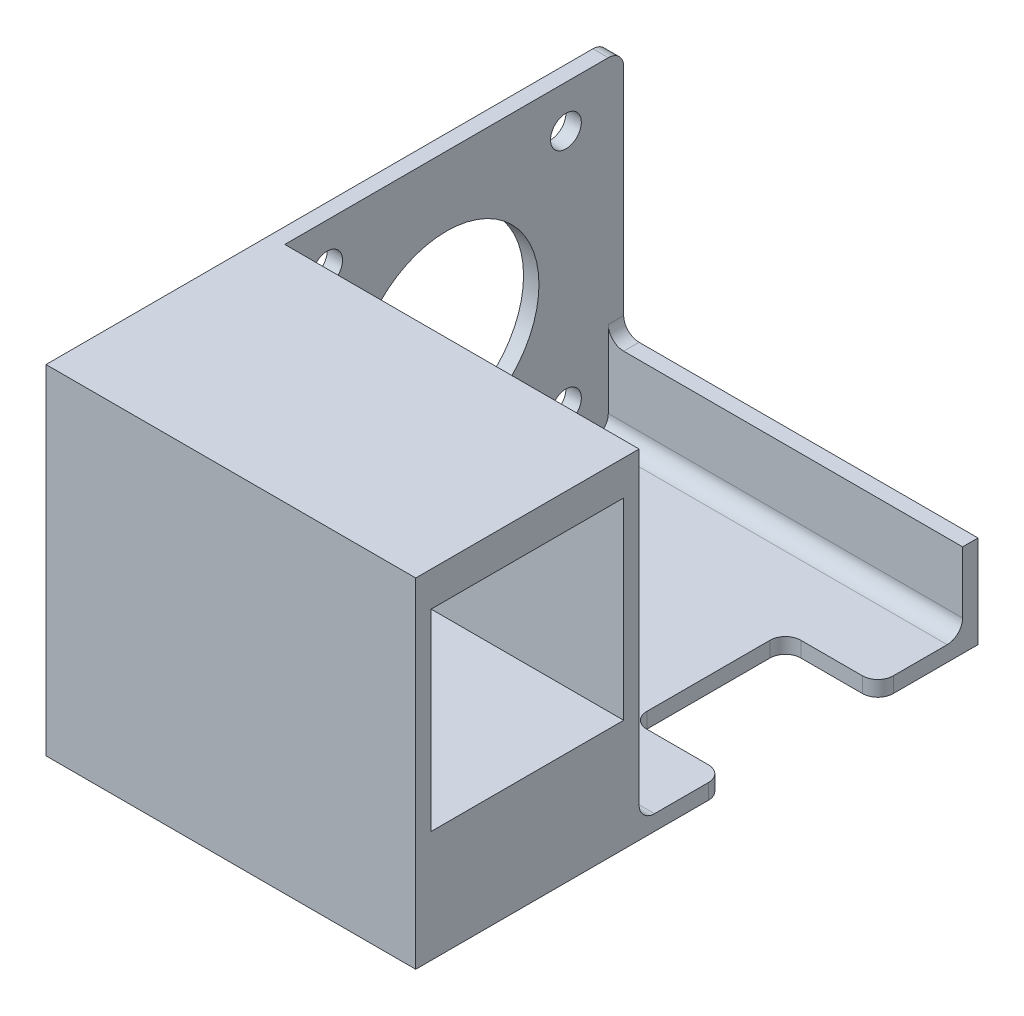
from build123d import *

# Parameters (mm, degrees)
SKETCH1_W                = 48
SKETCH1_H                = 29
BOSS_EXTRUDE1_DEPTH      = 29
SKETCH2_W                = 25
SKETCH2_H                = 25
CUT_EXTRUDE1_DEPTH       = 48
SKETCH3_W                = 48
SKETCH3_H                = 46
BOSS_EXTRUDE2_DEPTH      = 2
BOSS_EXTRUDE4_DEPTH      = 44
BOSS_EXTRUDE4_DEPTH_BACK = 2
SKETCH4_W                = 48
SKETCH4_H                = 2
SKETCH5_W                = 2
SKETCH5_H                = 46
BOSS_EXTRUDE5_DEPTH      = 44
SKETCH6_W                = 48
SKETCH6_H                = 12
BOSS_EXTRUDE6_DEPTH      = 2
SKETCH8_R                = 2
SKETCH8_R_2              = 12
CUT_EXTRUDE2_DEPTH       = 2
SKETCH9_W                = 12
SKETCH9_H                = 20
CUT_EXTRUDE3_DEPTH       = 2
FILLET4_R                = 2
SKETCH10_W               = 48
SKETCH10_H               = 10.5
BOSS_EXTRUDE7_DEPTH      = 29
SKETCH11_W               = 48
SKETCH11_H               = 2
CUT_EXTRUDE5_DEPTH       = 73
SKETCH13_W               = 25
SKETCH13_H               = 4
CUT_EXTRUDE6_DEPTH       = 73
SKETCH14_W               = 28
SKETCH14_H               = 14.5
BOSS_EXTRUDE10_DEPTH     = 48
FILLET5_R                = 2
FILLET6_R                = 2
FILLET7_R                = 2
FILLET8_R                = 2


with BuildPart() as part:
    # Sketch1 → Boss-Extrude1 (new body)
    with BuildSketch(Plane.XY):
        Rectangle(SKETCH1_W, SKETCH1_H)
    extrude(amount=BOSS_EXTRUDE1_DEPTH)

    # Sketch2 → Cut-Extrude1 (cut)
    with BuildSketch(Plane.ZY.offset(24)):
        with Locations((14.5, 0)):
            Rectangle(SKETCH2_W, SKETCH2_H)
    extrude(amount=-CUT_EXTRUDE1_DEPTH, mode=Mode.SUBTRACT)

    # Sketch3 → Boss-Extrude2 (add)
    with BuildSketch(Plane(origin=(0, 0, 0), x_dir=(-1, 0, 0), z_dir=(0, 0, -1))):
        Rectangle(SKETCH3_W, SKETCH3_H)
    extrude(amount=-BOSS_EXTRUDE2_DEPTH)

    # Sketch4 → Boss-Extrude4 (add, two sides: drawn at the far end of the back side and taken through both)
    with BuildSketch(Plane(origin=(0, 0, 0), x_dir=(-1, 0, 0), z_dir=(0, 0, -1)).offset(-BOSS_EXTRUDE4_DEPTH_BACK)):
        with Locations((0, -22)):
            Rectangle(SKETCH4_W, SKETCH4_H)
    extrude(amount=BOSS_EXTRUDE4_DEPTH + BOSS_EXTRUDE4_DEPTH_BACK)

    # Sketch5 → Boss-Extrude5 (add)
    with BuildSketch(Plane(origin=(0, 0, 0), x_dir=(-1, 0, 0), z_dir=(0, 0, -1))):
        with Locations((23, 0)):
            Rectangle(SKETCH5_W, SKETCH5_H)
    extrude(amount=BOSS_EXTRUDE5_DEPTH)

    # Sketch6 → Boss-Extrude6 (add)
    with BuildSketch(Plane(origin=(0, 0, -44), x_dir=(-1, 0, 0), z_dir=(0, 0, -1))):
        with Locations((0, -17)):
            Rectangle(SKETCH6_W, SKETCH6_H)
    extrude(amount=-BOSS_EXTRUDE6_DEPTH)

    # Sketch8 → Cut-Extrude2 (cut)
    with BuildSketch(Plane.ZY.offset(24)):
        with Locations(Location((-36.5, 15.5, 0), (0, 0, 270))):
            Circle(SKETCH8_R)
        with Locations(Location((-5.5, 15.5, 0), (0, 0, 270))):
            Circle(SKETCH8_R)
        with Locations(Location((-5.5, -15.5, 0), (0, 0, 270))):
            Circle(SKETCH8_R)
        with Locations(Location((-36.5, -15.5, 0), (0, 0, 270))):
            Circle(SKETCH8_R)
        with Locations(Location((-21, 0, 0), (0, 0, 270))):
            Circle(SKETCH8_R_2)
    extrude(amount=-CUT_EXTRUDE2_DEPTH, mode=Mode.SUBTRACT)

    # Sketch9 → Cut-Extrude3 (cut)
    with BuildSketch(Plane(origin=(0, -21, 0), x_dir=(1, 0, 0), z_dir=(0, 1, 0))):
        with Locations((18, 21)):
            Rectangle(SKETCH9_W, SKETCH9_H)
    extrude(amount=-CUT_EXTRUDE3_DEPTH, mode=Mode.SUBTRACT)

    # Fillet4
    fillet4_edges = [part.edges().sort_by_distance(p)[0] for p in [
        (-22, -11, -43),
    ]]
    fillet(fillet4_edges, radius=FILLET4_R)

    # Sketch10 → Boss-Extrude7 (add)
    with BuildSketch(Plane.XY.offset(29)):
        with Locations((0, 17.75)):
            Rectangle(SKETCH10_W, SKETCH10_H)
        with Locations((0, -17.75)):
            Rectangle(SKETCH10_W, SKETCH10_H)
    extrude(amount=-BOSS_EXTRUDE7_DEPTH)

    # Sketch11 → Cut-Extrude5 (cut)
    with BuildSketch(Plane.XY.offset(29)):
        with Locations((0, 22)):
            Rectangle(SKETCH11_W, SKETCH11_H)
    extrude(amount=-CUT_EXTRUDE5_DEPTH, mode=Mode.SUBTRACT)

    # Sketch13 → Cut-Extrude6 (cut)
    with BuildSketch(Plane.ZY.offset(24)):
        with Locations((14.5, 14.5)):
            Rectangle(SKETCH13_W, SKETCH13_H)
    extrude(amount=-CUT_EXTRUDE6_DEPTH, mode=Mode.SUBTRACT)

    # Sketch14 → Boss-Extrude10 (add)
    with BuildSketch(Plane.ZY.offset(24)):
        with Locations((15, -15.75)):
            Rectangle(SKETCH14_W, SKETCH14_H)
    extrude(amount=-BOSS_EXTRUDE10_DEPTH)

    # Fillet5
    fillet5_edges = [part.edges().sort_by_distance(p)[0] for p in [
        (1, -21, 0),
    ]]
    fillet(fillet5_edges, radius=FILLET5_R)

    # Fillet6
    fillet6_edges = [part.edges().sort_by_distance(p)[0] for p in [
        (1, -21, -42),
    ]]
    fillet(fillet6_edges, radius=FILLET6_R)

    # Fillet7
    fillet7_edges = [part.edges().sort_by_distance(p)[0] for p in [
        (-23, 21, -44),
    ]]
    fillet(fillet7_edges, radius=FILLET7_R)

    # Fillet8
    fillet8_edges = [part.edges().sort_by_distance(p)[0] for p in [
        (24, -22, -31),
        (24, -22, -11),
        (12, -22, -11),
        (12, -22, -31),
    ]]
    fillet(fillet8_edges, radius=FILLET8_R)


solid = part.part
